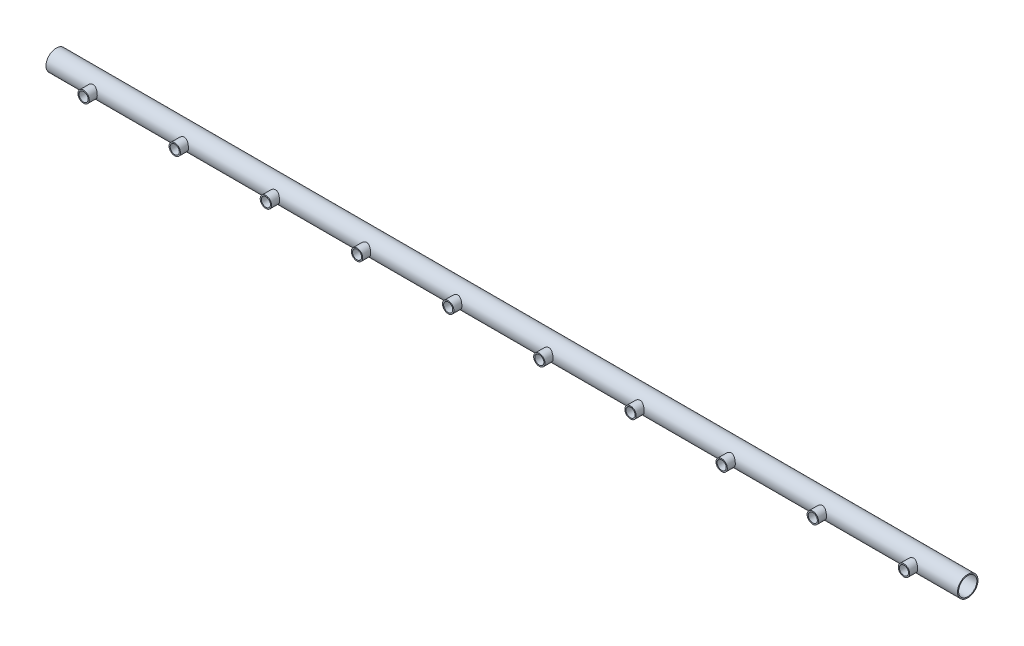
from build123d import *

# Parameters (mm, degrees)
SKETCH1_R           = 22.5
SKETCH1_R_2         = 20
BOSS_EXTRUDE1_DEPTH = 1000
SKETCH2_R           = 12.5
SKETCH2_R_2         = 10
BOSS_EXTRUDE2_DEPTH = 40
SKETCH3_R           = 20
CUT_EXTRUDE1_DEPTH  = 2001.526493304


with BuildPart() as part:
    # Sketch1 → Boss-Extrude1 (new, symmetric)
    with BuildSketch(Plane(origin=(0, 0, 0), x_dir=(0, 0, -1), z_dir=(1, 0, 0))):
        Circle(SKETCH1_R)
        Circle(SKETCH1_R_2, mode=Mode.SUBTRACT)
    extrude(amount=BOSS_EXTRUDE1_DEPTH, both=True)

    # Sketch2 → Boss-Extrude2 (add)
    # profile 1 of 10: a face of its own
    with BuildSketch(Plane.XY):
        with Locations((100, 0)):
            Circle(SKETCH2_R)
        with Locations((100, 0)):
            Circle(SKETCH2_R_2, mode=Mode.SUBTRACT)
    # profile 2 of 10: a face of its own
    with BuildSketch(Plane.XY):
        with Locations((300, 0)):
            Circle(SKETCH2_R)
        with Locations((300, 0)):
            Circle(SKETCH2_R_2, mode=Mode.SUBTRACT)
    # profile 3 of 10: a face of its own
    with BuildSketch(Plane.XY):
        with Locations((500, 0)):
            Circle(SKETCH2_R)
        with Locations((500, 0)):
            Circle(SKETCH2_R_2, mode=Mode.SUBTRACT)
    # profile 4 of 10: a face of its own
    with BuildSketch(Plane.XY):
        with Locations((700, 0)):
            Circle(SKETCH2_R)
        with Locations((700, 0)):
            Circle(SKETCH2_R_2, mode=Mode.SUBTRACT)
    # profile 5 of 10: a face of its own
    with BuildSketch(Plane.XY):
        with Locations((900, 0)):
            Circle(SKETCH2_R)
        with Locations((900, 0)):
            Circle(SKETCH2_R_2, mode=Mode.SUBTRACT)
    # profile 6 of 10: a face of its own
    with BuildSketch(Plane.XY):
        with Locations(Location((-900, 0, 0), (0, 0, 180))):
            Circle(SKETCH2_R)
        with Locations(Location((-900, 0, 0), (0, 0, 180))):
            Circle(SKETCH2_R_2, mode=Mode.SUBTRACT)
    # profile 7 of 10: a face of its own
    with BuildSketch(Plane.XY):
        with Locations(Location((-700, 0, 0), (0, 0, 180))):
            Circle(SKETCH2_R)
        with Locations(Location((-700, 0, 0), (0, 0, 180))):
            Circle(SKETCH2_R_2, mode=Mode.SUBTRACT)
    # profile 8 of 10: a face of its own
    with BuildSketch(Plane.XY):
        with Locations(Location((-500, 0, 0), (0, 0, 180))):
            Circle(SKETCH2_R)
        with Locations(Location((-500, 0, 0), (0, 0, 180))):
            Circle(SKETCH2_R_2, mode=Mode.SUBTRACT)
    # profile 9 of 10: a face of its own
    with BuildSketch(Plane.XY):
        with Locations(Location((-300, 0, 0), (0, 0, 180))):
            Circle(SKETCH2_R)
        with Locations(Location((-300, 0, 0), (0, 0, 180))):
            Circle(SKETCH2_R_2, mode=Mode.SUBTRACT)
    # profile 10 of 10: a face of its own
    with BuildSketch(Plane.XY):
        with Locations(Location((-100, 0, 0), (0, 0, 180))):
            Circle(SKETCH2_R)
        with Locations(Location((-100, 0, 0), (0, 0, 180))):
            Circle(SKETCH2_R_2, mode=Mode.SUBTRACT)
    extrude(amount=BOSS_EXTRUDE2_DEPTH)

    # Sketch3 → Cut-Extrude1 (cut, through all)
    with BuildSketch(Plane.ZY.offset(1000)):
        with Locations(Location((0, 0, 0), (0, 0, 180))):
            Circle(SKETCH3_R)
    extrude(amount=-CUT_EXTRUDE1_DEPTH, mode=Mode.SUBTRACT)


solid = part.part
